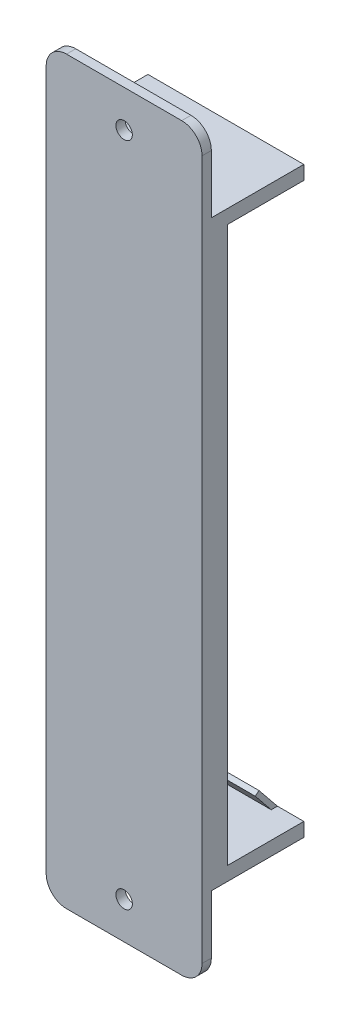
from build123d import *

# Parameters (mm, degrees)
BOSS_EXTRUDE3_DEPTH       = 12.7
BOSS_EXTRUDE3_DEPTH_BACK  = 88.9
BOSS_EXTRUDE4_DEPTH       = 76.2
SKETCH3_W                 = 21.40077
SKETCH3_H                 = 1.905
BOSS_EXTRUDE5_DEPTH       = 12.7
SKETCH4_W                 = 21.40077
SKETCH4_H                 = 1.905
BOSS_EXTRUDE6_DEPTH       = 12.7
BOSS_EXTRUDE7_DEPTH       = 17.78
CUT_EXTRUDE1_DEPTH        = 3.556
BOSS_EXTRUDE8_DEPTH       = 17.78
CUT_EXTRUDE2_DEPTH        = 3.556
F_4_40_TAPPED_HOLE1_D     = 2.2606
F_4_40_TAPPED_HOLE1_DEPTH = 7.62
F_4_40_TAPPED_HOLE1_TIP   = 0.679152758
FILLET1_R                 = 2.794


with BuildPart() as part:
    # Sketch2 → Boss-Extrude3 (new, two sides: drawn at the far end of the back side and taken through both)
    with BuildSketch(Plane(origin=(0, 0, 0), x_dir=(1, 0, 0), z_dir=(0, 1, 0)).offset(-BOSS_EXTRUDE3_DEPTH_BACK)):
        Polygon((10.700385, -10.700385), (0, -10.700385), (-10.700385, -10.700385), (-10.700385, -11.970385), (10.700385, -11.970385), align=None)
    extrude(amount=BOSS_EXTRUDE3_DEPTH + BOSS_EXTRUDE3_DEPTH_BACK)

    # Sketch2<3> → Boss-Extrude4 (add)
    with BuildSketch(Plane(origin=(0, 0, 0), x_dir=(1, 0, 0), z_dir=(0, 1, 0))):
        with BuildLine():
            ThreePointArc((0, -10.700385), (-3.462370633, -10.124733515), (-6.552209101, -8.459716014))
            Line((-6.552209101, -8.459716014), (-10.700385, -8.459716014))
            Line((-10.700385, -8.459716014), (-10.700385, -10.700385))
            Line((-10.700385, -10.700385), (0, -10.700385))
        make_face()
        with BuildLine():
            ThreePointArc((6.552209101, -8.459716014), (3.462370633, -10.124733515), (0, -10.700385))
            Line((0, -10.700385), (10.700385, -10.700385))
            Line((10.700385, -10.700385), (10.700385, -8.459716014))
            Line((10.700385, -8.459716014), (6.552209101, -8.459716014))
        make_face()
    extrude(amount=-BOSS_EXTRUDE4_DEPTH)

    # Sketch3 → Boss-Extrude5 (add)
    with BuildSketch(Plane(origin=(0, 0, 10.700385), x_dir=(-1, 0, 0), z_dir=(0, 0, -1))):
        with Locations((0, 0.9525)):
            Rectangle(SKETCH3_W, SKETCH3_H)
    extrude(amount=BOSS_EXTRUDE5_DEPTH)

    # Sketch4 → Boss-Extrude6 (add)
    with BuildSketch(Plane(origin=(0, 0, 10.700385), x_dir=(-1, 0, 0), z_dir=(0, 0, -1))):
        with Locations((0, -77.1525)):
            Rectangle(SKETCH4_W, SKETCH4_H)
    extrude(amount=BOSS_EXTRUDE6_DEPTH)

    # Sketch5 → Boss-Extrude7 (add)
    with BuildSketch(Plane(origin=(10.700385, 0, 0), x_dir=(0, 0, -1), z_dir=(1, 0, 0))):
        Polygon((-1.204354753, -3.186107507), (1.981752753, 0), (0.680653279, 0), (-1.971074087, -2.651727366), align=None)
    extrude(amount=-BOSS_EXTRUDE7_DEPTH)

    # Sketch5<4> → Cut-Extrude1 (cut)
    with BuildSketch(Plane(origin=(10.700385, 0, 0), x_dir=(0, 0, -1), z_dir=(1, 0, 0))):
        Polygon((-1.204354753, -3.186107507), (1.981752753, 0), (0.680653279, 0), (-1.971074087, -2.651727366), align=None)
    extrude(amount=-CUT_EXTRUDE1_DEPTH, mode=Mode.SUBTRACT)

    # Sketch6 → Boss-Extrude8 (add)
    with BuildSketch(Plane.ZY.offset(10.700385)):
        Polygon((0.530524719, -73.074012724), (-1.999615, -76.2), (-1.145153821, -76.2), (1.046780976, -73.49186486), align=None)
    extrude(amount=-BOSS_EXTRUDE8_DEPTH)

    # Sketch6<3> → Cut-Extrude2 (cut)
    with BuildSketch(Plane.ZY.offset(10.700385)):
        Polygon((0.530524719, -73.074012724), (-1.999615, -76.2), (-1.145153821, -76.2), (1.046780976, -73.49186486), align=None)
    extrude(amount=-CUT_EXTRUDE2_DEPTH, mode=Mode.SUBTRACT)

    # #4-40 Tapped Hole1
    with Locations(Plane(origin=(0, 0, 10.700385), x_dir=(-1, 0, 0), z_dir=(0, 0, -1))):
        with Locations((0, -83.82), (0, 7.62)):
            Hole(F_4_40_TAPPED_HOLE1_D / 2, depth=F_4_40_TAPPED_HOLE1_DEPTH)
            with Locations((0, 0, -(F_4_40_TAPPED_HOLE1_DEPTH + F_4_40_TAPPED_HOLE1_TIP / 2))):  # 118° drill point
                Cone(0, F_4_40_TAPPED_HOLE1_D / 2, F_4_40_TAPPED_HOLE1_TIP, mode=Mode.SUBTRACT)

    # Fillet1
    fillet1_edges = [part.edges().sort_by_distance(p)[0] for p in [
        (-10.700385, -88.9, 11.335385),
        (10.700385, -88.9, 11.335385),
        (-10.700385, 12.7, 11.335385),
        (10.700385, 12.7, 11.335385),
    ]]
    fillet(fillet1_edges, radius=FILLET1_R)


solid = part.part
